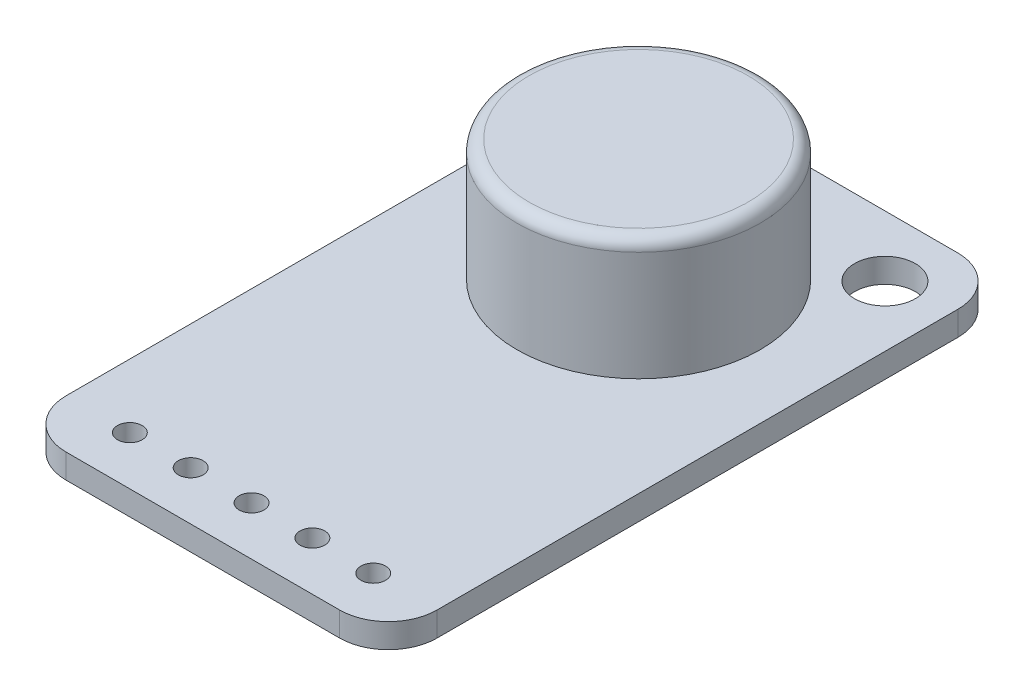
from build123d import *

# Parameters (mm, degrees)
SKETCH1_W           = 15.24
SKETCH1_H           = 25.4
BOSS_EXTRUDE1_DEPTH = 1
FILLET1_R           = 2
SKETCH2_R           = 1.25
SKETCH2_R_2         = 0.508
CUT_EXTRUDE1_DEPTH  = 1
SKETCH3_R           = 5
BOSS_EXTRUDE2_DEPTH = 5
FILLET2_R           = 0.5


with BuildPart() as part:
    # Sketch1 → Boss-Extrude1 (new body)
    with BuildSketch(Plane(origin=(0, 0, 0), x_dir=(1, 0, 0), z_dir=(0, 1, 0))):
        with Locations((-7.62, 12.7)):
            Rectangle(SKETCH1_W, SKETCH1_H)
    extrude(amount=BOSS_EXTRUDE1_DEPTH)

    # Fillet1
    fillet1_edges = [part.edges().sort_by_distance(p)[0] for p in [
        (0, 0.5, 0),
        (-15.24, 0.5, 0),
        (-15.24, 0.5, -25.4),
        (0, 0.5, -25.4),
    ]]
    fillet(fillet1_edges, radius=FILLET1_R)

    # Sketch2 → Cut-Extrude1 (cut)
    with BuildSketch(Plane(origin=(0, 1, 0), x_dir=(1, 0, 0), z_dir=(0, 1, 0))):
        with Locations(Location((-2.5, 22.9, 0), (0, 0, 270))):
            Circle(SKETCH2_R)
        with Locations(Location((-12.74, 22.9, 0), (0, 0, 270))):
            Circle(SKETCH2_R)
        with Locations(Location((-12.62, 2, 0), (0, 0, 270))):
            Circle(SKETCH2_R_2)
        with Locations(Location((-10.12, 2, 0), (0, 0, 270))):
            Circle(SKETCH2_R_2)
        with Locations(Location((-7.62, 2, 0), (0, 0, 270))):
            Circle(SKETCH2_R_2)
        with Locations(Location((-5.12, 2, 0), (0, 0, 270))):
            Circle(SKETCH2_R_2)
        with Locations(Location((-2.62, 2, 0), (0, 0, 270))):
            Circle(SKETCH2_R_2)
    extrude(amount=-CUT_EXTRUDE1_DEPTH, mode=Mode.SUBTRACT)

    # Sketch3 → Boss-Extrude2 (add)
    with BuildSketch(Plane(origin=(0, 1, 0), x_dir=(1, 0, 0), z_dir=(0, 1, 0))):
        with Locations(Location((-7.62, 17.9, 0), (0, 0, 270))):
            Circle(SKETCH3_R)
    extrude(amount=BOSS_EXTRUDE2_DEPTH)

    # Fillet2
    fillet2_edges = [part.edges().sort_by_distance(p)[0] for p in [
        (-7.62, 6, -22.9),
    ]]
    fillet(fillet2_edges, radius=FILLET2_R)


solid = part.part
